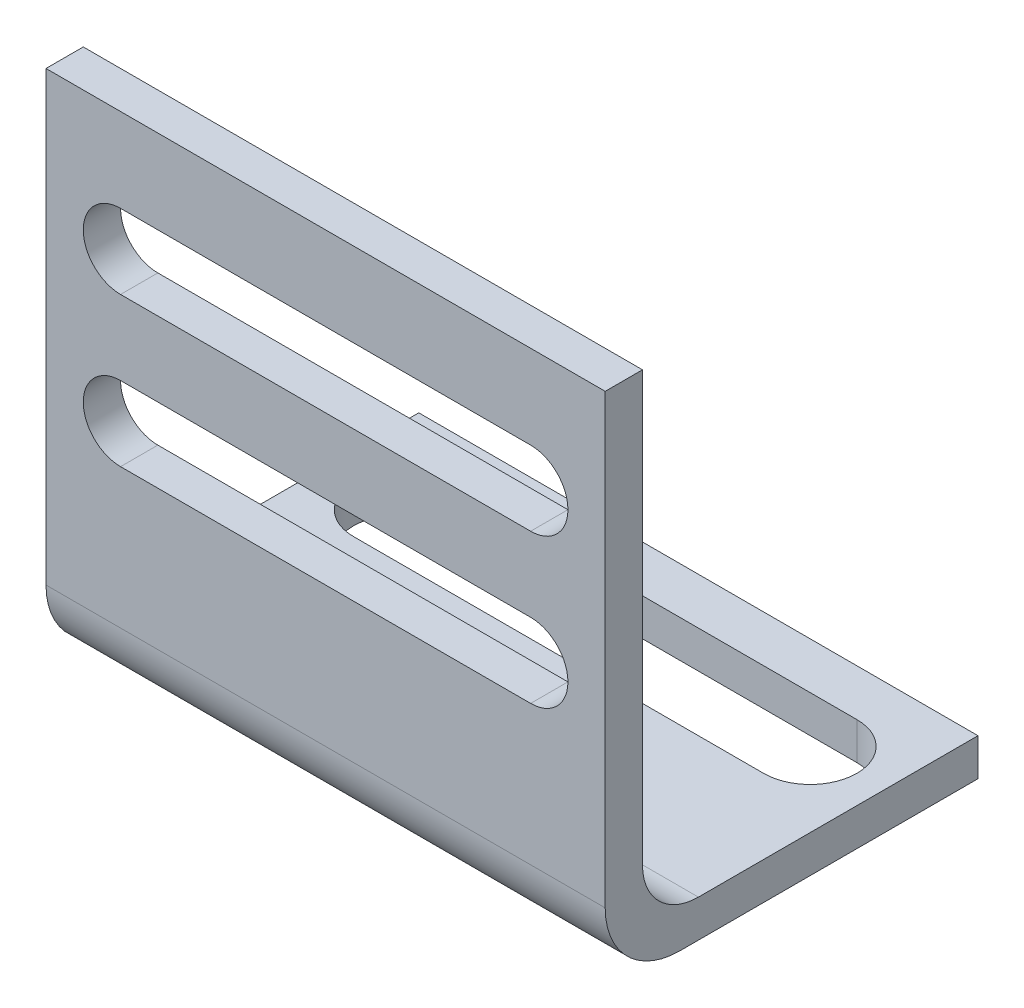
from build123d import *

# Parameters (mm, degrees)
EXTRUDE_1_DEPTH     = 30
CUT_EXTRUDE_1_DEPTH = 46.650848842
CUT_EXTRUDE_2_DEPTH = 46.650848842
FILLET_2_R          = 4
FILLET_3_R          = 3


with BuildPart() as part:
    # 草图1 → 凸台-拉伸1 (new body)
    with BuildSketch(Plane(origin=(0, 0, 0), x_dir=(0, 0, -1), z_dir=(1, 0, 0))):
        Polygon((0, 0), (0, -17.457543398), (0, -28), (3.576042669, -28), (20, -28), (20, -26), (3.746159887, -26), (2, -26), (2, -18.350485623), (2, 0), align=None)
    extrude(amount=EXTRUDE_1_DEPTH)

    # 草图3 → 切除-拉伸1 (cut, through all)
    with BuildSketch(Plane.XY):
        with BuildLine():
            Line((4, -12.5), (26, -12.5))
            ThreePointArc((26, -12.5), (28, -14.5), (26, -16.5))
            Line((26, -16.5), (4, -16.5))
            ThreePointArc((4, -16.5), (2, -14.5), (4, -12.5))
        make_face()
        with BuildLine():
            Line((4, -4.5), (26, -4.5))
            ThreePointArc((26, -4.5), (28, -6.5), (26, -8.5))
            Line((26, -8.5), (4, -8.5))
            ThreePointArc((4, -8.5), (2, -6.5), (4, -4.5))
        make_face()
    extrude(amount=-CUT_EXTRUDE_1_DEPTH, mode=Mode.SUBTRACT)

    # 草图4 → 切除-拉伸2 (cut, through all)
    with BuildSketch(Plane.XZ.offset(28)):
        with BuildLine():
            Line((4, -12.5), (26, -12.5))
            ThreePointArc((26, -12.5), (28.5, -15), (26, -17.5))
            Line((26, -17.5), (4, -17.5))
            ThreePointArc((4, -17.5), (1.5, -15), (4, -12.5))
        make_face()
    extrude(amount=-CUT_EXTRUDE_2_DEPTH, mode=Mode.SUBTRACT)

    # 圆角2
    fillet_2_edges = [part.edges().sort_by_distance(p)[0] for p in [
        (15, -28, 0),
    ]]
    fillet(fillet_2_edges, radius=FILLET_2_R)

    # 圆角3
    fillet_3_edges = [part.edges().sort_by_distance(p)[0] for p in [
        (15, -26, -2),
    ]]
    fillet(fillet_3_edges, radius=FILLET_3_R)


solid = part.part
